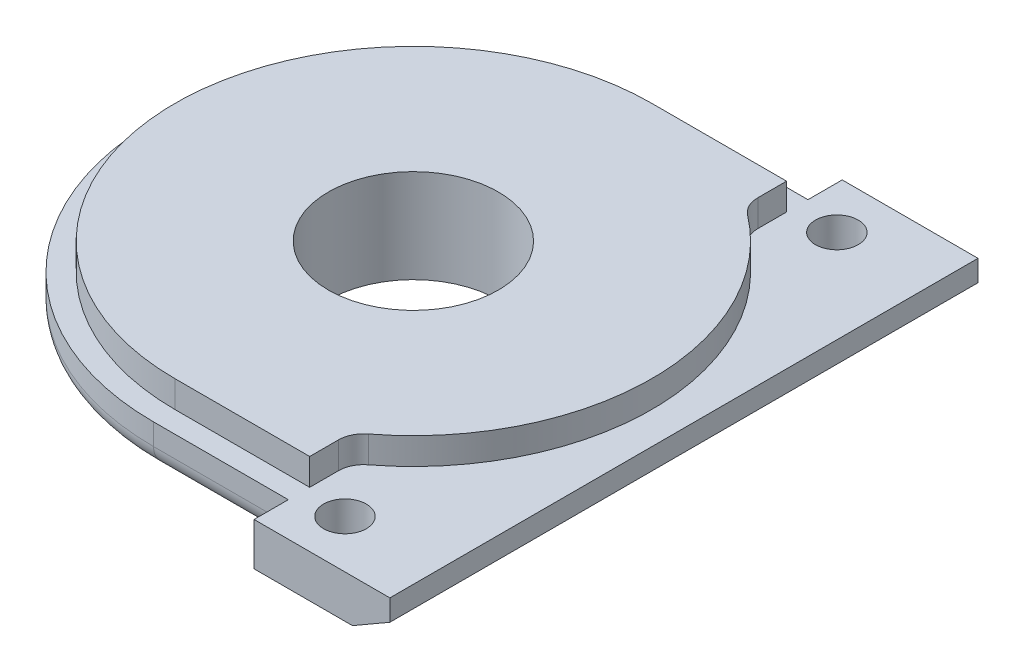
from build123d import *
from build123d.topology import SkipClean

# Parameters (mm, degrees)
BOSS_EXTRUDE1_DEPTH = 4
BOSS_EXTRUDE2_DEPTH = 2.5
SKETCH3_R           = 7.95
CUT_EXTRUDE1_DEPTH  = 9.25
SKETCH4_R           = 2
CUT_EXTRUDE2_DEPTH  = 9.25
CUT_EXTRUDE3_DEPTH  = 3.25
FILLET1_R           = 2.36
CHAMFER1_SIZE       = 3.5
CHAMFER1_SIZE2      = 2.020725942
BOSS_EXTRUDE4_DEPTH = 4
FILLET4_R           = 2
BOSS_EXTRUDE5_START = 2.25
SKETCH11_R          = 11.95
BOSS_EXTRUDE5_DEPTH = 2.25
CUT_EXTRUDE4_START  = -2.25
SKETCH12_R          = 7.95
CUT_EXTRUDE4_DEPTH  = 2.25
FILLET5_R           = 2.38


with BuildPart() as part:
    # Sketch1 → Boss-Extrude1 (new body)
    with BuildSketch(Plane(origin=(0, 0, 0), x_dir=(1, 0, 0), z_dir=(0, 1, 0))):
        with BuildLine():
            Line((-13.29118379, 20.889836125), (-0.68999579, 20.889836125))
            Line((-0.68999579, 20.889836125), (-0.68999579, 26.09210312))
            Line((-0.68999579, 26.09210312), (12.01000421, 26.09210312))
            Line((12.01000421, 26.09210312), (12.01000421, -28.90789688))
            Line((12.01000421, -28.90789688), (-0.68999579, -28.90789688))
            Line((-0.68999579, -28.90789688), (-0.68999579, -23.705629885))
            Line((-0.68999579, -23.705629885), (-13.29118379, -23.705629885))
            ThreePointArc((-13.29118379, -23.705629885), (-35.588916795, -1.40789688), (-13.29118379, 20.889836125))
        make_face()
    extrude(amount=BOSS_EXTRUDE1_DEPTH)

    # Sketch2 → Boss-Extrude2 (add)
    with BuildSketch(Plane(origin=(0, 4, 0), x_dir=(1, 0, 0), z_dir=(0, 1, 0))):
        with BuildLine():
            Line((-13.29118379, 20.889836125), (-0.68999579, 20.889836125))
            Line((-0.68999579, 20.889836125), (-0.68999579, 16.987726462))
            ThreePointArc((-0.68999579, 16.987726462), (9.006549215, -1.40789688), (-0.68999579, -19.803520222))
            Line((-0.68999579, -19.803520222), (-0.68999579, -23.705629885))
            Line((-0.68999579, -23.705629885), (-13.29118379, -23.705629885))
            ThreePointArc((-13.29118379, -23.705629885), (-35.588916795, -1.40789688), (-13.29118379, 20.889836125))
        make_face()
    extrude(amount=BOSS_EXTRUDE2_DEPTH)

    # Sketch3 → Cut-Extrude1 (cut)
    with BuildSketch(Plane.XZ):
        with Locations(Location((-13.29118379, 1.40789688, 0), (0, 0, 270))):
            Circle(SKETCH3_R)
    extrude(amount=-CUT_EXTRUDE1_DEPTH, mode=Mode.SUBTRACT)

    # Sketch4 → Cut-Extrude2 (cut)
    with BuildSketch(Plane.XZ):
        with Locations(Location((3.31000421, 24.40789688, 0), (0, 0, 270))):
            Circle(SKETCH4_R)
        with Locations(Location((3.310004206, -21.59210312, 0), (0, 0, 270))):
            Circle(SKETCH4_R)
    extrude(amount=-CUT_EXTRUDE2_DEPTH, mode=Mode.SUBTRACT)

    # Sketch5 → Cut-Extrude3 (cut)
    with BuildSketch(Plane.XZ):
        with BuildLine():
            ThreePointArc((-20.917233099, -7.792422241), (-25.24118379, 1.40789688), (-20.917233099, 10.608216001))
            Line((-20.917233099, 10.608216001), (-24.193916765, 16.291878661))
            ThreePointArc((-24.193916765, 16.291878661), (-31.74118379, 1.40789688), (-24.193916765, -13.476084902))
            Line((-24.193916765, -13.476084902), (-20.917233099, -7.792422241))
        make_face()
        with BuildLine():
            Line((-20.729723635, 18.291931497), (-17.445869217, 12.612408873))
            ThreePointArc((-17.445869217, 12.612408873), (-7.31618379, 11.756900455), (-1.510449053, 3.412089752))
            Line((-1.510449053, 3.412089752), (5.05008903, 3.407949716))
            ThreePointArc((5.05008903, 3.407949716), (-4.06618379, 17.38606558), (-20.729723635, 18.291931497))
        make_face()
        with BuildLine():
            ThreePointArc((-1.510449053, -0.596295992), (-7.31618379, -8.941106696), (-17.445869217, -9.796615113))
            Line((-17.445869217, -9.796615113), (-20.729723635, -15.476137738))
            ThreePointArc((-20.729723635, -15.476137738), (-4.06618379, -14.57027182), (5.05008903, -0.592155956))
            Line((5.05008903, -0.592155956), (-1.510449053, -0.596295992))
        make_face()
    extrude(amount=-CUT_EXTRUDE3_DEPTH, mode=Mode.SUBTRACT)

    # Fillet1
    fillet1_edges = [part.edges().sort_by_distance(p)[0] for p in [
        (-20.917233099, 1.625, 10.608216001),
        (-20.917233099, 1.625, -7.792422241),
        (-24.193916765, 1.625, -13.476084902),
        (-24.193916765, 1.625, 16.291878661),
        (5.05008903, 1.625, 3.407949716),
        (-1.510449053, 1.625, 3.412089752),
        (-20.729723635, 1.625, 18.291931497),
        (-1.510449053, 1.625, -0.596295992),
        (5.05008903, 1.625, -0.592155956),
        (-20.729723635, 1.625, -15.476137738),
    ]]
    fillet(fillet1_edges, radius=FILLET1_R)

    # Chamfer1
    chamfer1_edges = [part.edges().sort_by_distance(p)[0] for p in [
        (12.01000421, 0, 1.40789688),
    ]]
    chamfer1_side = [part.faces().sort_by_distance(p)[0] for p in [
        (-3.702499267, 0, 18.015985651),
    ]]
    chamfer(chamfer1_edges, length=CHAMFER1_SIZE, length2=CHAMFER1_SIZE2, reference=chamfer1_side[0])

    # Sketch10 → Boss-Extrude4 (add)
    with BuildSketch(Plane.XZ):
        with BuildLine():
            Line((-0.68999579, -22.889836125), (-13.29118379, -22.889836125))
            ThreePointArc((-13.29118379, -22.889836125), (-37.588916795, 1.40789688), (-13.29118379, 25.705629885))
            Line((-13.29118379, 25.705629885), (-0.68999579, 25.705629885))
            Line((-0.68999579, 25.705629885), (-0.68999579, 23.705629885))
            Line((-0.68999579, 23.705629885), (-13.29118379, 23.705629885))
            ThreePointArc((-13.29118379, 23.705629885), (-35.588916795, 1.40789688), (-13.29118379, -20.889836125))
            Line((-13.29118379, -20.889836125), (-0.68999579, -20.889836125))
            Line((-0.68999579, -20.889836125), (-0.68999579, -22.889836125))
        make_face()
    extrude(amount=-BOSS_EXTRUDE4_DEPTH)

    # Fillet4
    fillet4_edges = [part.edges().sort_by_distance(p)[0] for p in [
        (-6.99058979, 0, 25.705629885),
        (-37.588916795, 0, 1.40789688),
        (-6.99058979, 0, -22.889836125),
    ]]
    fillet(fillet4_edges, radius=FILLET4_R)

    # Sketch11 → Boss-Extrude5 (add)
    with SkipClean():  # the faces are left unmerged after this step: merging them gives an invalid solid
        with BuildSketch(Plane.XZ.offset(BOSS_EXTRUDE5_START)):
            with Locations(Location((-13.29118379, 1.40789688, 0), (0, 0, 270))):
                Circle(SKETCH11_R)
        extrude(amount=-BOSS_EXTRUDE5_DEPTH)

    # Sketch12 → Cut-Extrude4 (cut)
    with SkipClean():  # the faces are left unmerged after this step: merging them gives an invalid solid
        with BuildSketch(Plane(origin=(0, 0, 0), x_dir=(1, 0, 0), z_dir=(0, 1, 0)).offset(CUT_EXTRUDE4_START)):
            with Locations(Location((-13.29118379, -1.40789688, 0), (0, 0, 270))):
                Circle(SKETCH12_R)
        extrude(amount=CUT_EXTRUDE4_DEPTH, mode=Mode.SUBTRACT)

    # Fillet5
    fillet5_edges = [part.edges().sort_by_distance(p)[0] for p in [
        (-0.68999579, 5.25, 19.803520222),
        (-0.68999579, 5.25, -16.987726462),
    ]]
    fillet(fillet5_edges, radius=FILLET5_R)


solid = part.part
